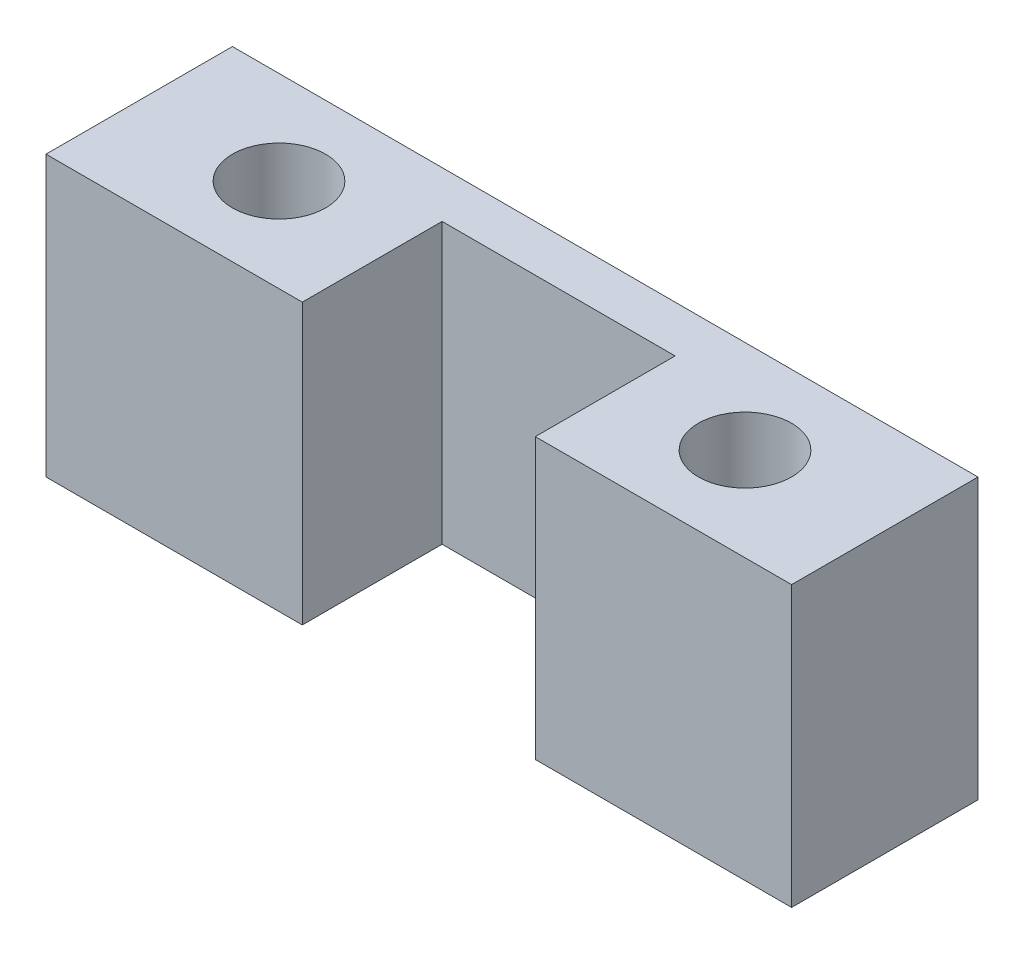
from build123d import *

# Parameters (mm, degrees)
SKETCH1_W           = 50.8
SKETCH1_H           = 12.7
BOSS_EXTRUDE1_DEPTH = 19.05
SKETCH2_R           = 3.175
CUT_EXTRUDE1_DEPTH  = 15.875
SKETCH3_W           = 15.875
SKETCH3_H           = 9.525
CUT_EXTRUDE2_DEPTH  = 33.378773911


with BuildPart() as part:
    # Sketch1 → Boss-Extrude1 (new body)
    with BuildSketch(Plane(origin=(0, 0, 0), x_dir=(1, 0, 0), z_dir=(0, 1, 0))):
        Rectangle(SKETCH1_W, SKETCH1_H)
    extrude(amount=BOSS_EXTRUDE1_DEPTH)

    # Sketch2 → Cut-Extrude1 (cut)
    with BuildSketch(Plane(origin=(0, 19.05, 0), x_dir=(1, 0, 0), z_dir=(0, 1, 0))):
        with Locations(Location((-15.875, 0, 0), (0, 0, 270))):
            Circle(SKETCH2_R)
        with Locations(Location((15.875, 0, 0), (0, 0, 270))):
            Circle(SKETCH2_R)
    extrude(amount=-CUT_EXTRUDE1_DEPTH, mode=Mode.SUBTRACT)

    # Sketch3 → Cut-Extrude2 (cut, through all)
    with BuildSketch(Plane(origin=(0, 19.05, 0), x_dir=(1, 0, 0), z_dir=(0, 1, 0))):
        with Locations((0, -1.5875)):
            Rectangle(SKETCH3_W, SKETCH3_H)
    extrude(amount=-CUT_EXTRUDE2_DEPTH, mode=Mode.SUBTRACT)


solid = part.part
